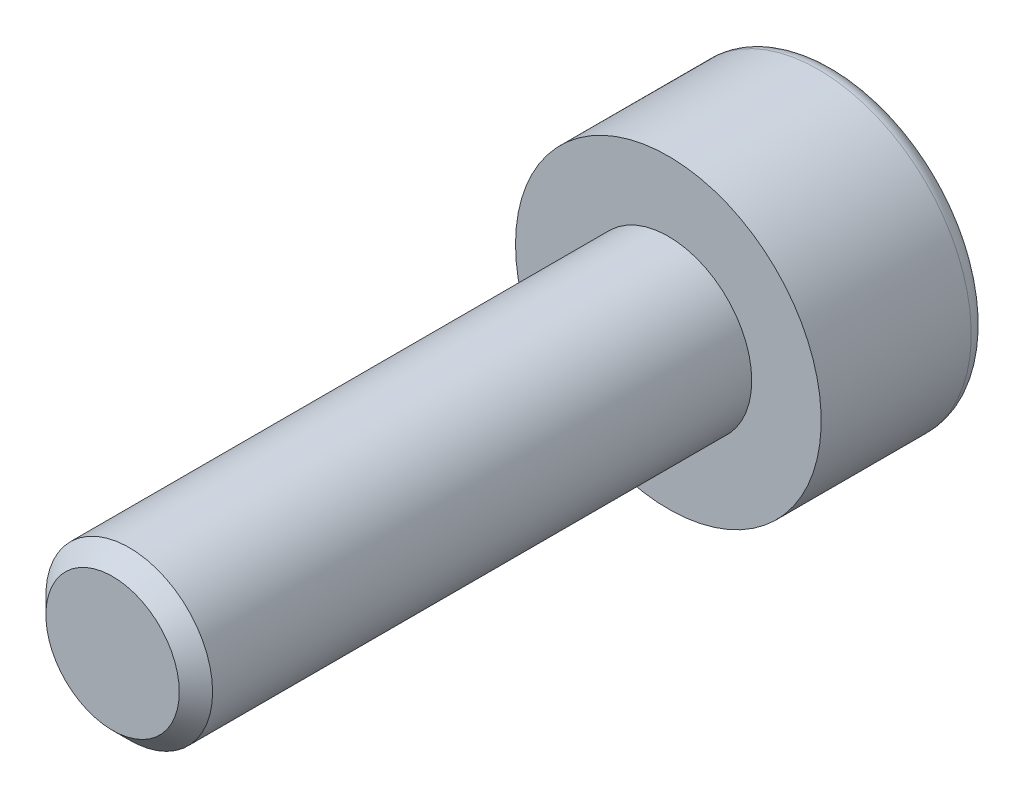
from build123d import *

# Parameters (mm, degrees)
ENLEV_MAT_EXTRU1_DEPTH = 2
ESQUISSE3_W            = 1.5
ESQUISSE3_H            = 10
CHANFREIN1_SIZE        = 0.3


with BuildPart() as part:
    # Esquisse1 → Base-Révolution (revolve)
    with BuildSketch(Plane(origin=(0, 0, 0), x_dir=(1, 0, 0), z_dir=(0, 1, 0))):
        with BuildLine():
            Line((0, 0), (2.75, 0))
            Line((2.75, 0), (2.75, 2.7))
            ThreePointArc((2.75, 2.7), (2.662132034, 2.912132034), (2.45, 3))
            Line((2.45, 3), (0, 3))
            Line((0, 3), (0, 0))
        make_face()
    revolve(axis=Axis((0, 0, 0), (0, 0, -1)))

    # Esquisse2 → enlev-mat-Extru1 (cut)
    with BuildSketch(Plane.XY.offset(-3)):
        Polygon((1.5, -0.866025404), (1.5, 0.866025404), (0, 1.732050808), (-1.5, 0.866025404), (-1.5, -0.866025404), (0, -1.732050808), align=None)
    extrude(amount=ENLEV_MAT_EXTRU1_DEPTH, mode=Mode.SUBTRACT)

    # Esquisse3 → Boss.-Révol.1 (revolve)
    with BuildSketch(Plane(origin=(0, 0, 0), x_dir=(1, 0, 0), z_dir=(0, 1, 0))):
        with Locations((0.75, -5)):
            Rectangle(ESQUISSE3_W, ESQUISSE3_H)
    revolve(axis=Axis((0, 0, 0), (0, 0, 1)))

    # Chanfrein1
    chanfrein1_edges = [part.edges().sort_by_distance(p)[0] for p in [
        (-1.5, 0, 10),
    ]]
    chamfer(chanfrein1_edges, length=CHANFREIN1_SIZE)


solid = part.part
